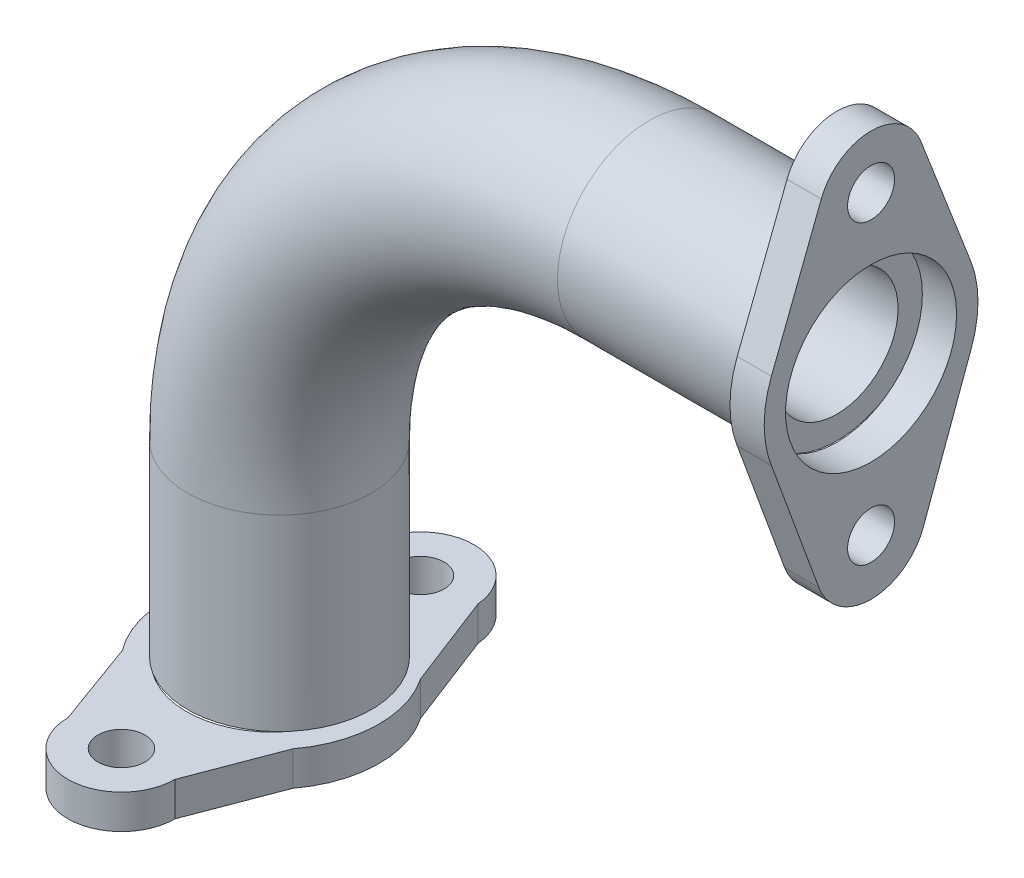
from build123d import *

# Parameters (mm, degrees)
SWEEP1_PROFILE_R    = 21.5
BOSS_EXTRUDE1_DEPTH = 8
BOSS_EXTRUDE2_DEPTH = 8
SKETCH10_R          = 20
CUT_EXTRUDE1_DEPTH  = 8
SKETCH12_R          = 20
CUT_EXTRUDE2_DEPTH  = 8
SKETCH13_R          = 5.5
CUT_EXTRUDE3_DEPTH  = 22
SKETCH14_R          = 5.5
CUT_EXTRUDE4_DEPTH  = 22
SKETCH26_R          = 14.308639319
CUT_EXTRUDE6_DEPTH  = 75
SKETCH27_R          = 17.5
CUT_EXTRUDE8_DEPTH  = 46


with BuildPart() as part:
    # Sweep1: sweep along a path in Sketch1
    with BuildLine(Plane.XY) as sweep1_path:
        Line((-15.173427297, 84.340140469), (-59.008690724, 84.340140469))
        ThreePointArc((-59.008690724, 84.340140469), (-120.173427297, 59.004877041), (-145.508690724, -2.159859531))
        Line((-145.508690724, -2.159859531), (-145.508690724, -45.995122959))
    # Sweep1 profile (on start of the path) → Sweep1 (sweep)
    with BuildSketch(Plane(origin=(-15.173427297, 84.340140469, 0), x_dir=(0, 0, -1), z_dir=(-1, 0, 0))):
        Circle(SWEEP1_PROFILE_R)
    sweep(path=sweep1_path.line)

    # Sketch8 → Boss-Extrude1 (add)
    with BuildSketch(Plane(origin=(-15.173427297, 0, 0), x_dir=(0, 0, -1), z_dir=(1, 0, 0))):
        with BuildLine():
            Line((11.654299247, 121.647035289), (23.308607816, 91.595469986))
            ThreePointArc((23.308607816, 91.595469986), (25.000007686, 82.556156629), (23.308607816, 73.516843272))
            Line((23.308607816, 73.516843272), (12.201254362, 43.23933866))
            ThreePointArc((12.201254362, 43.23933866), (0, 34.751015799), (-12.201254362, 43.23933866))
            Line((-12.201254362, 43.23933866), (-23.308607816, 73.516843272))
            ThreePointArc((-23.308607816, 73.516843272), (-25.000007686, 82.556156629), (-23.308607816, 91.595469986))
            Line((-23.308607816, 91.595469986), (-11.654299247, 121.647035289))
            ThreePointArc((-11.654299247, 121.647035289), (0, 129.627377221), (11.654299247, 121.647035289))
        make_face()
    extrude(amount=BOSS_EXTRUDE1_DEPTH)

    # Sketch9 → Boss-Extrude2 (add)
    with BuildSketch(Plane.XZ.offset(45.995122959)):
        with BuildLine():
            Line((-157.861790456, 37.103058549), (-165.135770102, 17.103058549))
            ThreePointArc((-165.135770102, 17.103058549), (-170.186132718, 1.393320876), (-164.347898171, -14.040960373))
            Line((-164.347898171, -14.040960373), (-157.880174747, -34.040960373))
            ThreePointArc((-157.880174747, -34.040960373), (-145.361790456, -45.396941451), (-132.972897727, -33.899829272))
            Line((-132.972897727, -33.899829272), (-124.515630897, -12.02434059))
            ThreePointArc((-124.515630897, -12.02434059), (-120.202124379, 2.657801138), (-125.252486994, 17.103058549))
            Line((-125.252486994, 17.103058549), (-132.861790456, 37.103058549))
            ThreePointArc((-132.861790456, 37.103058549), (-145.361790456, 49.603058549), (-157.861790456, 37.103058549))
        make_face()
    extrude(amount=BOSS_EXTRUDE2_DEPTH)

    # Sketch10 → Cut-Extrude1 (cut)
    with BuildSketch(Plane(origin=(-7.173427297, 0, 0), x_dir=(0, 0, -1), z_dir=(1, 0, 0))):
        with Locations((0, 82.556156629)):
            Circle(SKETCH10_R)
    extrude(amount=-CUT_EXTRUDE1_DEPTH, mode=Mode.SUBTRACT)

    # Sketch12 → Cut-Extrude2 (cut)
    with BuildSketch(Plane.XZ.offset(53.995122959)):
        with Locations(Location((-145.194128548, 2.025561007, 0), (0, 0, 270))):
            Circle(SKETCH12_R)
    extrude(amount=-CUT_EXTRUDE2_DEPTH, mode=Mode.SUBTRACT)

    # Sketch13 → Cut-Extrude3 (cut)
    with BuildSketch(Plane.XZ.offset(45.995122959)):
        with Locations(Location((-145.361790456, 37.103058549, 0), (0, 0, 270))):
            Circle(SKETCH13_R)
        with Locations(Location((-145.432617565, -32.897142112, 0), (0, 0, 270))):
            Circle(SKETCH13_R)
    extrude(amount=CUT_EXTRUDE3_DEPTH, mode=Mode.SUBTRACT)

    # Sketch14 → Cut-Extrude4 (cut)
    with BuildSketch(Plane(origin=(-7.173427297, 0, 0), x_dir=(0, 0, -1), z_dir=(1, 0, 0))):
        with Locations((0, 117.127377221)):
            Circle(SKETCH14_R)
        with Locations((0, 47.764318698)):
            Circle(SKETCH14_R)
    extrude(amount=-CUT_EXTRUDE4_DEPTH, mode=Mode.SUBTRACT)

    # Sketch26 → Cut-Extrude6 (cut)
    with BuildSketch(Plane(origin=(-15.173427297, 0, 0), x_dir=(0, 0, -1), z_dir=(1, 0, 0))):
        with Locations((0, 82.556156629)):
            Circle(SKETCH26_R)
    extrude(amount=-CUT_EXTRUDE6_DEPTH, mode=Mode.SUBTRACT)

    # Sketch27 → Cut-Extrude8 (cut)
    with BuildSketch(Plane.XZ.offset(45.995122959)):
        with Locations(Location((-145.508690724, 0, 0), (0, 0, 270))):
            Circle(SKETCH27_R)
    extrude(amount=-CUT_EXTRUDE8_DEPTH, mode=Mode.SUBTRACT)


solid = part.part
